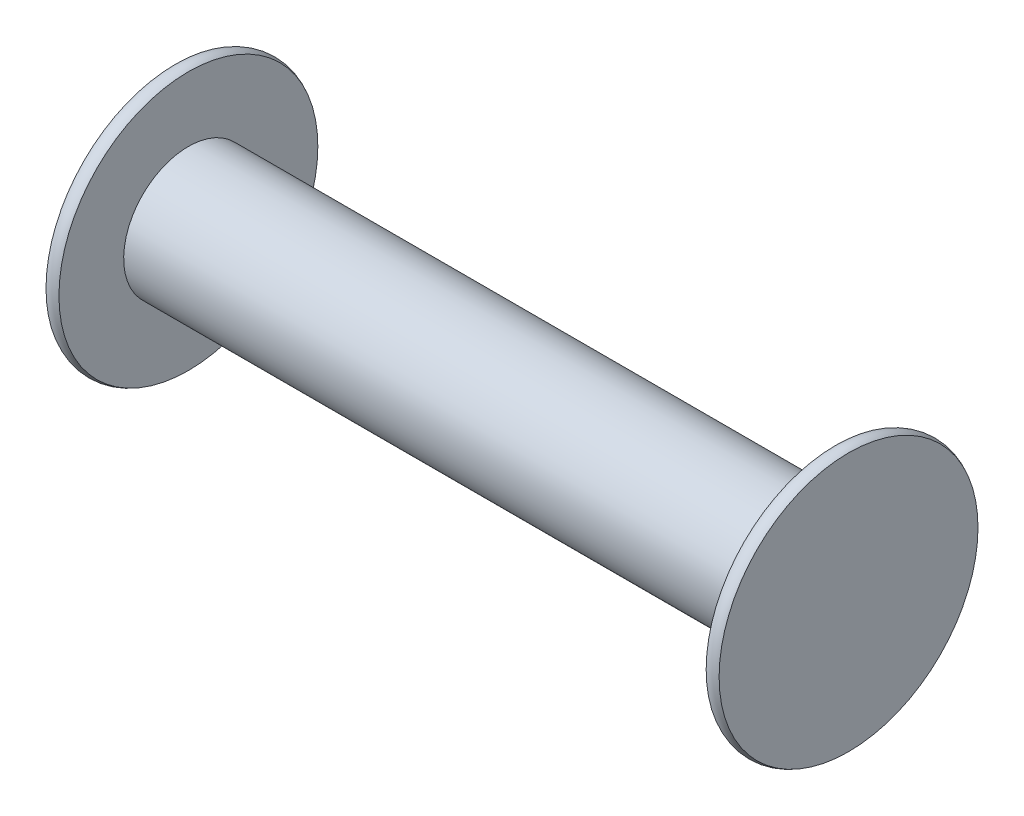
from build123d import *


with BuildPart() as part:
    # Sketch1 → Revolve1 (revolve)
    with BuildSketch(Plane.XY):
        with BuildLine():
            Line((-26, 0), (26, 0))
            Line((26, 0), (26, -10))
            ThreePointArc((26, -10), (25.5, -10.133974596), (25, -10))
            Line((25, -10), (25, -5))
            Line((25, -5), (-25, -5))
            Line((-25, -5), (-25, -10))
            ThreePointArc((-25, -10), (-25.5, -10.133974596), (-26, -10))
            Line((-26, -10), (-26, 0))
        make_face()
    revolve(axis=Axis((-26, 0, 0), (1, 0, 0)))


solid = part.part
